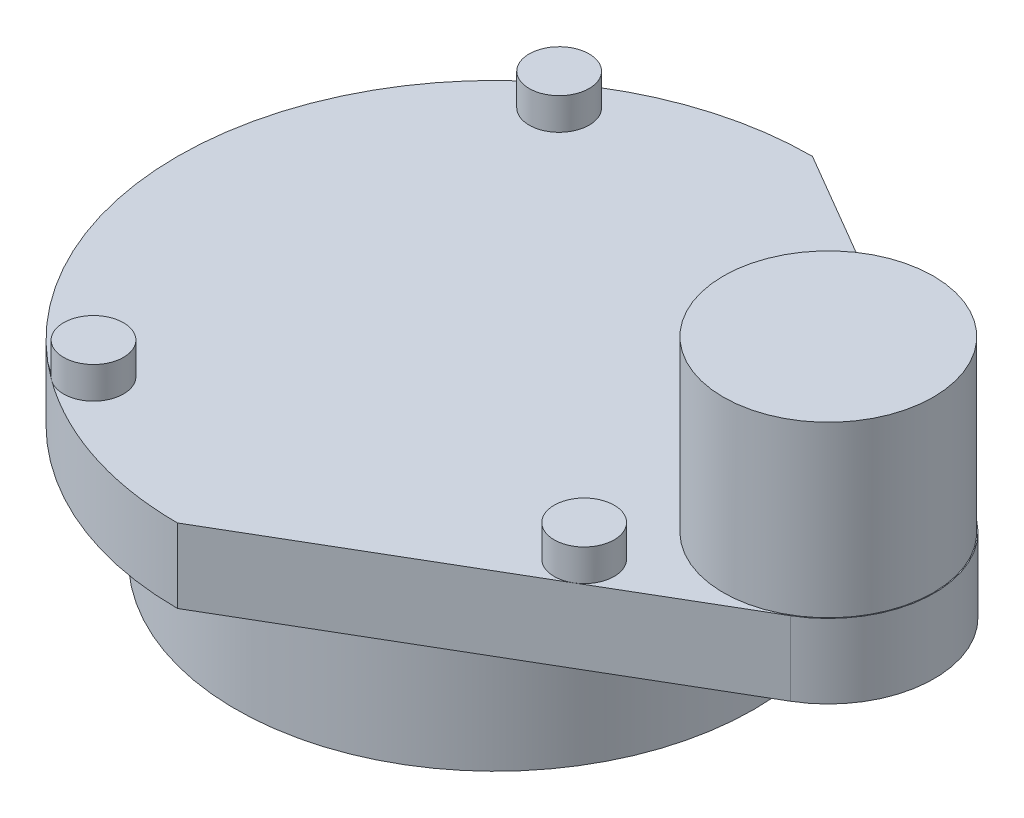
from build123d import *

# Parameters (mm, degrees)
BOSS_EXTRUDE1_START = -15.875
SKETCH1_R           = 38.89375
BOSS_EXTRUDE1_DEPTH = 17.4625
BOSS_EXTRUDE2_START = 15.875
BOSS_EXTRUDE2_DEPTH = 11.1125
BOSS_EXTRUDE3_REACH = 89.863
SKETCH3_R           = 4.5
SKETCH4_R           = 15.748
BOSS_EXTRUDE4_DEPTH = 25.4


with BuildPart() as part:
    # Sketch1 → Boss-Extrude1 (new body)
    with BuildSketch(Plane(origin=(0, 0, 0), x_dir=(1, 0, 0), z_dir=(0, 1, 0)).offset(BOSS_EXTRUDE1_START)):
        Circle(SKETCH1_R)
    extrude(amount=-BOSS_EXTRUDE1_DEPTH)

    # Sketch2 → Boss-Extrude2 (add)
    with BuildSketch(Plane(origin=(0, 0, 0), x_dir=(-1, 0, 0), z_dir=(0, -1, 0)).offset(BOSS_EXTRUDE2_START)):
        with BuildLine():
            Line((-58.018619526, 13.704654669), (0, 47.625))
            ThreePointArc((0, 47.625), (47.625, 0), (0, -47.625))
            Line((0, -47.625), (-58.018619526, -13.704654669))
            ThreePointArc((-58.018619526, -13.704654669), (-65.88125, 0), (-58.018619526, 13.704654669))
        make_face()
    extrude(amount=-BOSS_EXTRUDE2_DEPTH)

    # Sketch3 → Boss-Extrude3 (add, up to next)
    with BuildSketch(Plane(origin=(0, 0, 0), x_dir=(-1, 0, 0), z_dir=(0, -1, 0)), mode=Mode.PRIVATE) as boss_extrude3_sk1:
        with Locations(Location((-35.208032093, 21.828125, 0), (0, 0, 120.312514276))):
            Circle(SKETCH3_R)
    boss_extrude3_tool1 = extrude(boss_extrude3_sk1.sketch, amount=BOSS_EXTRUDE3_REACH, mode=Mode.PRIVATE) - part.part
    # Sketch3 → Boss-Extrude3 (add, up to next)
    with BuildSketch(Plane(origin=(0, 0, 0), x_dir=(-1, 0, 0), z_dir=(0, -1, 0)), mode=Mode.PRIVATE) as boss_extrude3_sk2:
        with Locations(Location((-35.208032093, -21.828125, 0), (0, 0, 239.687485724))):
            Circle(SKETCH3_R)
    boss_extrude3_tool2 = extrude(boss_extrude3_sk2.sketch, amount=BOSS_EXTRUDE3_REACH, mode=Mode.PRIVATE) - part.part
    # Sketch3 → Boss-Extrude3 (add, up to next)
    with BuildSketch(Plane(origin=(0, 0, 0), x_dir=(-1, 0, 0), z_dir=(0, -1, 0)), mode=Mode.PRIVATE) as boss_extrude3_sk3:
        with Locations(Location((25.298418923, -34.925, 0), (0, 0, 305.918677721))):
            Circle(SKETCH3_R)
    boss_extrude3_tool3 = extrude(boss_extrude3_sk3.sketch, amount=BOSS_EXTRUDE3_REACH, mode=Mode.PRIVATE) - part.part
    # Sketch3 → Boss-Extrude3 (add, up to next)
    with BuildSketch(Plane(origin=(0, 0, 0), x_dir=(-1, 0, 0), z_dir=(0, -1, 0)), mode=Mode.PRIVATE) as boss_extrude3_sk4:
        with Locations(Location((25.298418923, 34.925, 0), (0, 0, 54.082225764))):
            Circle(SKETCH3_R)
    boss_extrude3_tool4 = extrude(boss_extrude3_sk4.sketch, amount=BOSS_EXTRUDE3_REACH, mode=Mode.PRIVATE) - part.part
    add(boss_extrude3_tool1.solids().sort_by_distance((35.208032, 0, -21.828125))[0])
    add(boss_extrude3_tool2.solids().sort_by_distance((35.208032, 0, 21.828125))[0])
    add(boss_extrude3_tool3.solids().sort_by_distance((-25.298419, 0, 34.925))[0])
    add(boss_extrude3_tool4.solids().sort_by_distance((-25.298419, 0, -34.925))[0])

    # Sketch4 → Boss-Extrude4 (add)
    with BuildSketch(Plane(origin=(0, -4.7625, 0), x_dir=(1, 0, 0), z_dir=(0, 1, 0))):
        with Locations((50.00625, 0)):
            Circle(SKETCH4_R)
    extrude(amount=BOSS_EXTRUDE4_DEPTH)


solid = part.part
